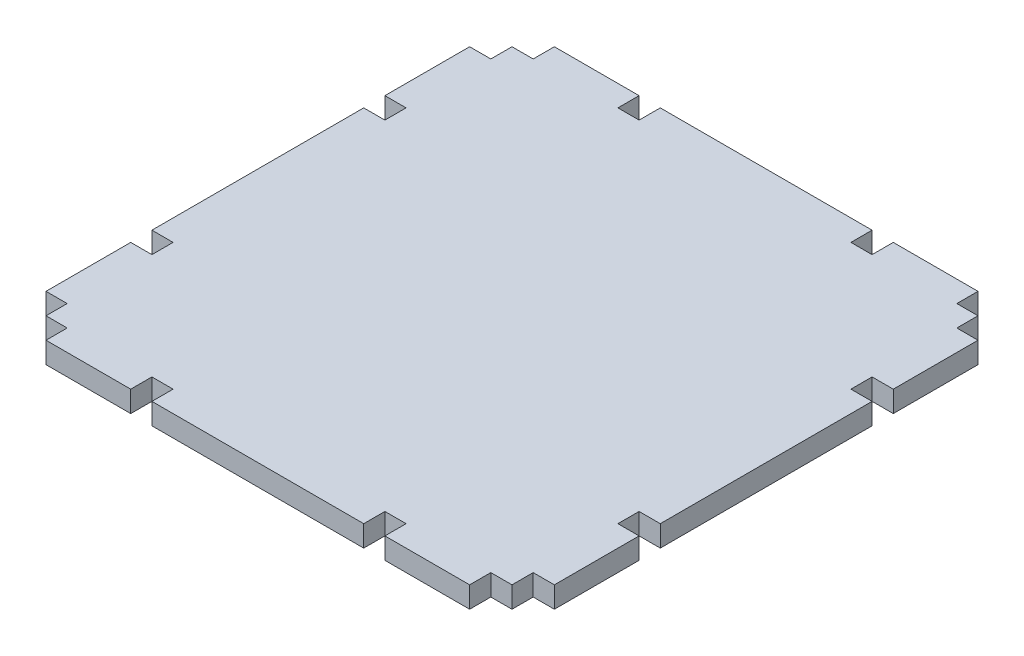
from build123d import *

# Parameters (mm, degrees)
BOSS_EXTRUDE1_DEPTH = 6.35


with BuildPart() as part:
    # Sketch1 → Boss-Extrude1 (new body)
    with BuildSketch(Plane(origin=(0, 0, 0), x_dir=(1, 0, 0), z_dir=(0, 1, 0))):
        Polygon((-76.2, -38.1), (-76.2, -63.5), (-69.85, -63.5), (-69.85, -69.85), (-63.5, -69.85), (-63.5, -76.2), (-38.1, -76.2), (-38.1, -69.85), (-31.75, -69.85), (-31.75, -76.2), (31.75, -76.2), (31.75, -69.85), (38.1, -69.85), (38.1, -76.2), (63.5, -76.2), (63.5, -69.85), (69.85, -69.85), (69.85, -63.5), (76.2, -63.5), (76.2, -38.1), (69.85, -38.1), (69.85, -31.75), (76.2, -31.75), (76.2, 31.75), (69.85, 31.75), (69.85, 38.1), (76.2, 38.1), (76.2, 63.5), (69.85, 63.5), (69.85, 69.85), (63.5, 69.85), (63.5, 76.2), (38.1, 76.2), (38.1, 69.85), (31.75, 69.85), (31.75, 76.2), (-31.75, 76.2), (-31.75, 69.85), (-38.1, 69.85), (-38.1, 76.2), (-63.5, 76.2), (-63.5, 69.85), (-69.85, 69.85), (-69.85, 63.5), (-76.2, 63.5), (-76.2, 38.1), (-69.85, 38.1), (-69.85, 31.75), (-76.2, 31.75), (-76.2, -31.75), (-69.85, -31.75), (-69.85, -38.1), align=None)
    extrude(amount=BOSS_EXTRUDE1_DEPTH)


solid = part.part
